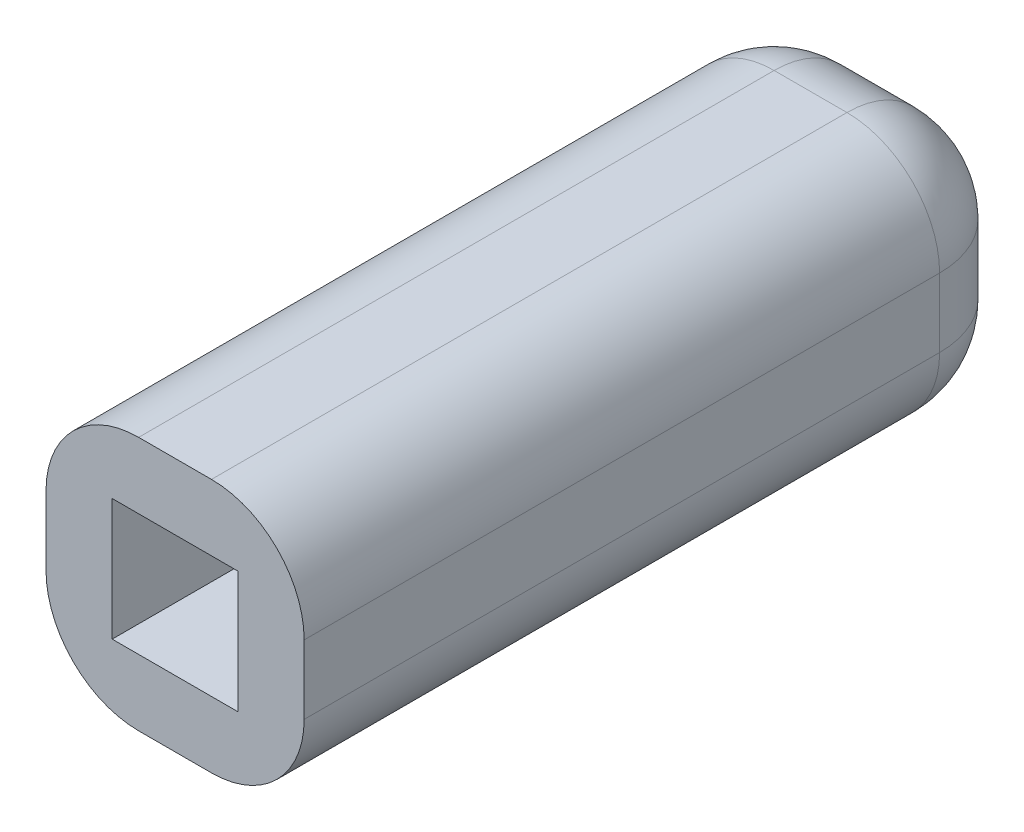
from build123d import *

# Parameters (mm, degrees)
SKETCH1_W           = 19.5
SKETCH1_H           = 19.2
SKETCH1_W_2         = 9.5
SKETCH1_H_2         = 9.2
BOSS_EXTRUDE1_DEPTH = 55
SKETCH1_2_W         = 9.5
SKETCH1_2_H         = 9.2
BOSS_EXTRUDE2_DEPTH = 25
FILLET2_R           = 7


with BuildPart() as part:
    # Sketch1 → Boss-Extrude1 (new body)
    with BuildSketch(Plane.XY):
        with Locations((4.75, 4.6)):
            Rectangle(SKETCH1_W, SKETCH1_H)
        with Locations((4.75, 4.6)):
            Rectangle(SKETCH1_W_2, SKETCH1_H_2, mode=Mode.SUBTRACT)
    extrude(amount=BOSS_EXTRUDE1_DEPTH)

    # Sketch1<2> → Boss-Extrude2 (add)
    with BuildSketch(Plane.XY):
        with Locations((4.75, 4.6)):
            Rectangle(SKETCH1_2_W, SKETCH1_2_H)
    extrude(amount=BOSS_EXTRUDE2_DEPTH)

    # Fillet2
    fillet2_edges = [part.edges().sort_by_distance(p)[0] for p in [
        (4.75, 14.2, 0),
        (14.5, 4.6, 0),
        (4.75, -5, 0),
        (-5, 4.6, 0),
        (-5, 14.2, 27.5),
        (14.5, 14.2, 27.5),
        (14.5, -5, 27.5),
        (-5, -5, 27.5),
    ]]
    fillet(fillet2_edges, radius=FILLET2_R)


solid = part.part
